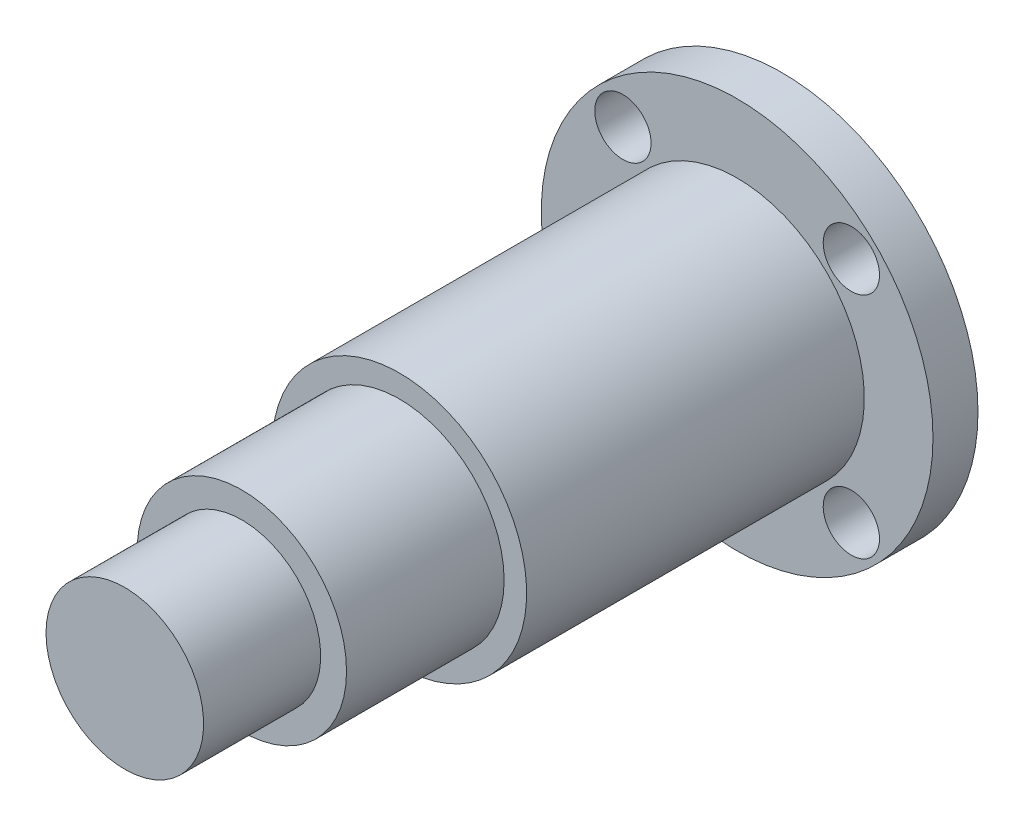
from build123d import *

# Parameters (mm, degrees)
SKETCH1_R           = 22.098
BOSS_EXTRUDE1_DEPTH = 5.08
SKETCH2_R           = 14.351
BOSS_EXTRUDE2_DEPTH = 38.1
SKETCH3_R           = 11.811
BOSS_EXTRUDE3_DEPTH = 17.78
SKETCH4_R           = 8.89
BOSS_EXTRUDE4_DEPTH = 13.208
SKETCH6_R           = 3.175
CUT_EXTRUDE1_DEPTH  = 5.08
CIRPATTERN1_COUNT   = 4


with BuildPart() as part:
    # Sketch1 → Boss-Extrude1 (new body)
    with BuildSketch(Plane.XY):
        Circle(SKETCH1_R)
    extrude(amount=BOSS_EXTRUDE1_DEPTH)

    # Sketch2 → Boss-Extrude2 (add)
    with BuildSketch(Plane.XY.offset(5.08)):
        with Locations(Location((0, 0, 0), (0, 0, 180))):
            Circle(SKETCH2_R)
    extrude(amount=BOSS_EXTRUDE2_DEPTH)

    # Sketch3 → Boss-Extrude3 (add)
    with BuildSketch(Plane.XY.offset(43.18)):
        Circle(SKETCH3_R)
    extrude(amount=BOSS_EXTRUDE3_DEPTH)

    # Sketch4 → Boss-Extrude4 (add)
    with BuildSketch(Plane.XY.offset(60.96)):
        with Locations(Location((0, 0, 0), (0, 0, 180))):
            Circle(SKETCH4_R)
    extrude(amount=BOSS_EXTRUDE4_DEPTH)

    # Sketch6 → Cut-Extrude1 (cut)
    with BuildSketch(Plane(origin=(0, 0, 0), x_dir=(-1, 0, 0), z_dir=(0, 0, -1))):
        with Locations((-12.886667534, 12.886667534)):
            Circle(SKETCH6_R)
    cut_extrude1 = extrude(amount=-CUT_EXTRUDE1_DEPTH, mode=Mode.SUBTRACT)

    # CirPattern1: Cut-Extrude1 ×4 about axis
    cirpattern1_axis = Axis((0, 0, 0), (0, 0, 1))
    for i in range(1, CIRPATTERN1_COUNT):
        add(cut_extrude1.rotate(cirpattern1_axis, i * 360 / CIRPATTERN1_COUNT), mode=Mode.SUBTRACT)


solid = part.part
